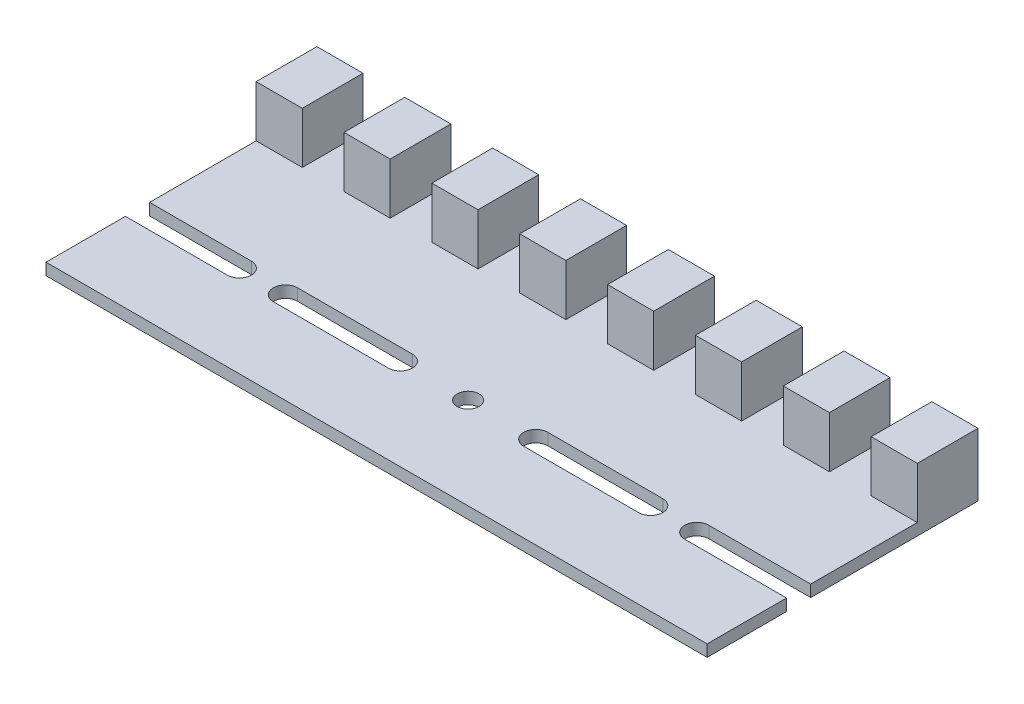
from build123d import *

# Parameters (mm, degrees)
SKETCH_1_W          = 90.3
SKETCH_1_H          = 37
EXTRUDE_1_DEPTH     = 1.6
SKETCH_3_R          = 1.5
CUT_EXTRUDE_1_DEPTH = 1.6
SKETCH_4_W          = 6.3
SKETCH_4_H          = 8.293497289
EXTRUDE_2_DEPTH     = 7


with BuildPart() as part:
    # 草图1 → 凸台-拉伸1 (new body)
    with BuildSketch(Plane(origin=(0, 0, 0), x_dir=(1, 0, 0), z_dir=(0, 1, 0))):
        Rectangle(SKETCH_1_W, SKETCH_1_H)
    extrude(amount=EXTRUDE_1_DEPTH)

    # 草图3 → 切除-拉伸1 (cut)
    with BuildSketch(Plane(origin=(0, 1.6, 0), x_dir=(1, 0, 0), z_dir=(0, 1, 0))):
        with Locations(Location((0, -6, 0), (0, 0, 270))):
            Circle(SKETCH_3_R)
        with BuildLine():
            Line((-31.238672513, -7.65), (-53.101992088, -7.65))
            ThreePointArc((-53.101992088, -7.65), (-54.751992088, -6), (-53.101992088, -4.35))
            Line((-53.101992088, -4.35), (-31.238672513, -4.35))
            ThreePointArc((-31.238672513, -4.35), (-29.588672513, -6), (-31.238672513, -7.65))
        make_face()
        with BuildLine():
            Line((-24.944724021, -4.35), (-9.244724021, -4.35))
            ThreePointArc((-9.244724021, -4.35), (-7.594724021, -6), (-9.244724021, -7.65))
            Line((-9.244724021, -7.65), (-24.944724021, -7.65))
            ThreePointArc((-24.944724021, -7.65), (-26.594724021, -6), (-24.944724021, -4.35))
        make_face()
        with BuildLine():
            Line((31.238672513, -7.65), (53.101992088, -7.65))
            ThreePointArc((53.101992088, -7.65), (54.751992088, -6), (53.101992088, -4.35))
            Line((53.101992088, -4.35), (31.238672513, -4.35))
            ThreePointArc((31.238672513, -4.35), (29.588672513, -6), (31.238672513, -7.65))
        make_face()
        with BuildLine():
            Line((24.944724021, -4.35), (9.244724021, -4.35))
            ThreePointArc((9.244724021, -4.35), (7.594724021, -6), (9.244724021, -7.65))
            Line((9.244724021, -7.65), (24.944724021, -7.65))
            ThreePointArc((24.944724021, -7.65), (26.594724021, -6), (24.944724021, -4.35))
        make_face()
    extrude(amount=-CUT_EXTRUDE_1_DEPTH, mode=Mode.SUBTRACT)

    # 草图4 → 凸台-拉伸2 (add)
    with BuildSketch(Plane(origin=(0, 1.6, 0), x_dir=(1, 0, 0), z_dir=(0, 1, 0))):
        with Locations((-30, 14.353251355)):
            Rectangle(SKETCH_4_W, SKETCH_4_H)
        with Locations((-42, 14.353251355)):
            Rectangle(SKETCH_4_W, SKETCH_4_H)
        with Locations((-18, 14.353251355)):
            Rectangle(SKETCH_4_W, SKETCH_4_H)
        with Locations((-6, 14.353251355)):
            Rectangle(SKETCH_4_W, SKETCH_4_H)
        with Locations((6, 14.353251355)):
            Rectangle(SKETCH_4_W, SKETCH_4_H)
        with Locations((18, 14.353251355)):
            Rectangle(SKETCH_4_W, SKETCH_4_H)
        with Locations((30, 14.353251355)):
            Rectangle(SKETCH_4_W, SKETCH_4_H)
        with Locations((42, 14.353251355)):
            Rectangle(SKETCH_4_W, SKETCH_4_H)
    extrude(amount=EXTRUDE_2_DEPTH)


solid = part.part
